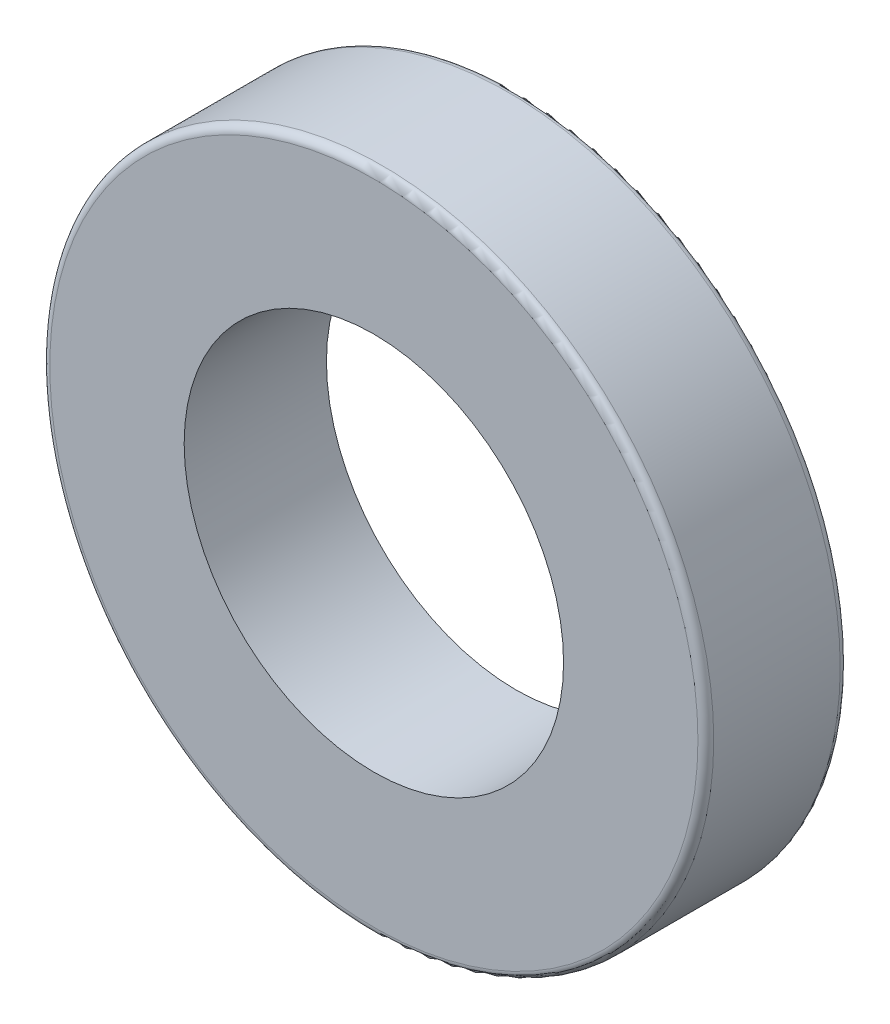
from build123d import *

# Parameters (mm, degrees)
SKETCH1_R           = 21
SKETCH1_R_2         = 12
BOSS_EXTRUDE1_DEPTH = 9
FILLET1_R           = 0.5


with BuildPart() as part:
    # Sketch1 → Boss-Extrude1 (new body)
    with BuildSketch(Plane.XY):
        Circle(SKETCH1_R)
        Circle(SKETCH1_R_2, mode=Mode.SUBTRACT)
    extrude(amount=-BOSS_EXTRUDE1_DEPTH)

    # Fillet1
    fillet1_edges = [part.edges().sort_by_distance(p)[0] for p in [
        (-21, 0, 0),
        (-21, 0, -9),
    ]]
    fillet(fillet1_edges, radius=FILLET1_R)


solid = part.part
